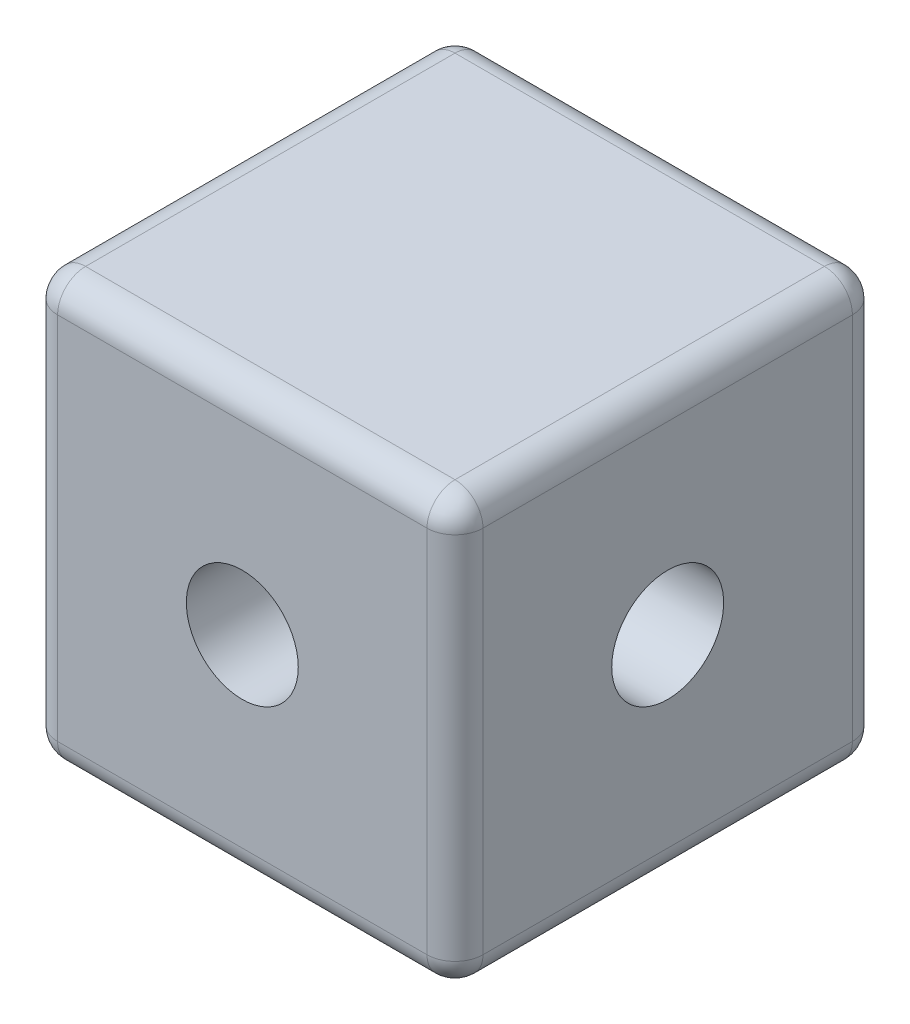
from build123d import *

# Parameters (mm, degrees)
SKETCH2_W           = 7.6
SKETCH2_H           = 7.6
BOSS_EXTRUDE1_DEPTH = 7.6
FILLET1_R           = 0.5
SKETCH3_R           = 1
CUT_EXTRUDE1_DEPTH  = 10
CUT_EXTRUDE2_REACH  = 13.4
SKETCH4_R           = 1


with BuildPart() as part:
    # Sketch2 → Boss-Extrude1 (new body)
    with BuildSketch(Plane(origin=(0, 0, 0), x_dir=(1, 0, 0), z_dir=(0, 1, 0))):
        Rectangle(SKETCH2_W, SKETCH2_H)
    extrude(amount=BOSS_EXTRUDE1_DEPTH)

    # Fillet1
    fillet1_edges = [part.edges().sort_by_distance(p)[0] for p in [
        (-3.8, 7.6, 0),
        (0, 7.6, 3.8),
        (3.8, 7.6, 0),
        (0, 0, 3.8),
        (-3.8, 0, 0),
        (0, 0, -3.8),
        (3.8, 0, 0),
        (3.8, 3.8, 3.8),
        (-3.8, 3.8, 3.8),
        (-3.8, 3.8, -3.8),
        (3.8, 3.8, -3.8),
        (0, 7.6, -3.8),
    ]]
    fillet(fillet1_edges, radius=FILLET1_R)

    # Sketch3 → Cut-Extrude1 (cut)
    with BuildSketch(Plane.ZY.offset(3.8)):
        with Locations((0, 3.8)):
            Circle(SKETCH3_R)
    extrude(amount=-CUT_EXTRUDE1_DEPTH, mode=Mode.SUBTRACT)

    # Cut-Extrude2: up to this face of the body (flat: up to its plane)
    cut_extrude2_end = Plane(part.part.faces().sort_by_distance((0, 3.8, -3.8))[0])
    # Sketch4 → Cut-Extrude2 (cut, up to the picked face)
    with BuildSketch(Plane.XY.offset(3.8), mode=Mode.PRIVATE) as cut_extrude2_sk1:
        with Locations((0, 3.8)):
            Circle(SKETCH4_R)
    cut_extrude2_tool1 = split(extrude(cut_extrude2_sk1.sketch, amount=-CUT_EXTRUDE2_REACH, mode=Mode.PRIVATE), bisect_by=cut_extrude2_end, keep=Keep.BOTH, mode=Mode.PRIVATE)
    add(cut_extrude2_tool1.solids().sort_by(Axis((0, 3.8, 3.8), (0, 0, -1)))[0], mode=Mode.SUBTRACT)


solid = part.part
